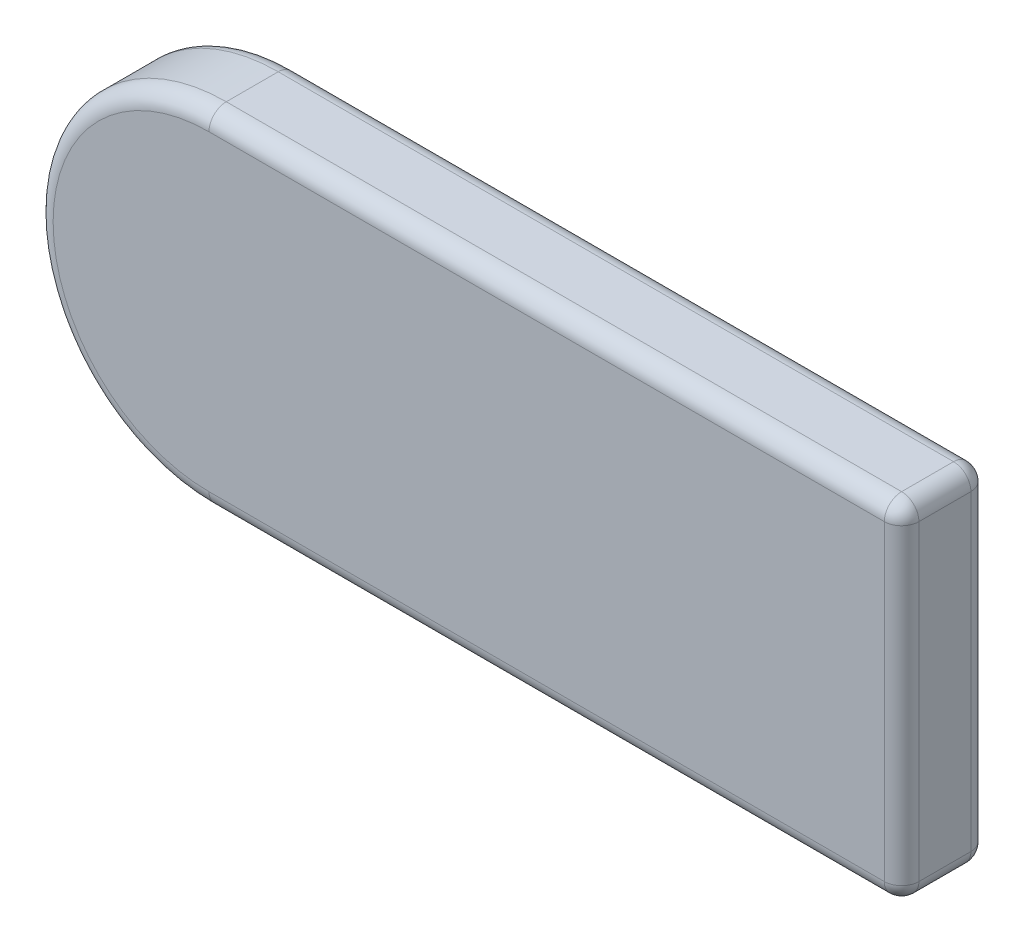
from build123d import *

# Parameters (mm, degrees)
EXTRUDE_1_DEPTH = 0.5
FILLET_2_R      = 0.1
FILLET_1_R      = 0.1


with BuildPart() as part:
    # Эскиз1 → Бобышка-Вытянуть1 (new body)
    with BuildSketch(Plane.XY):
        with BuildLine():
            Line((2, -1), (-2, -1))
            ThreePointArc((-2, -1), (-3, 0), (-2, 1))
            Line((-2, 1), (2, 1))
            Line((2, 1), (2, -1))
        make_face()
    extrude(amount=EXTRUDE_1_DEPTH)

    # Скругление2
    fillet_2_edges = [part.edges().sort_by_distance(p)[0] for p in [
        (2, -1, 0.25),
        (2, 1, 0.25),
    ]]
    fillet(fillet_2_edges, radius=FILLET_2_R)

    # Скругление1
    fillet_1_edges = [part.edges().sort_by_distance(p)[0] for p in [
        (-3, 0, 0.5),
        (2, 0, 0),
        (2, 0, 0.5),
        (-0.05, -1, 0),
        (-0.05, 1, 0),
        (1.970710678, 0.970710678, 0),
        (1.970710678, -0.970710678, 0),
        (-0.05, -1, 0.5),
        (-0.05, 1, 0.5),
        (1.970710678, 0.970710678, 0.5),
        (1.970710678, -0.970710678, 0.5),
        (-3, 0, 0),
    ]]
    fillet(fillet_1_edges, radius=FILLET_1_R)


solid = part.part
